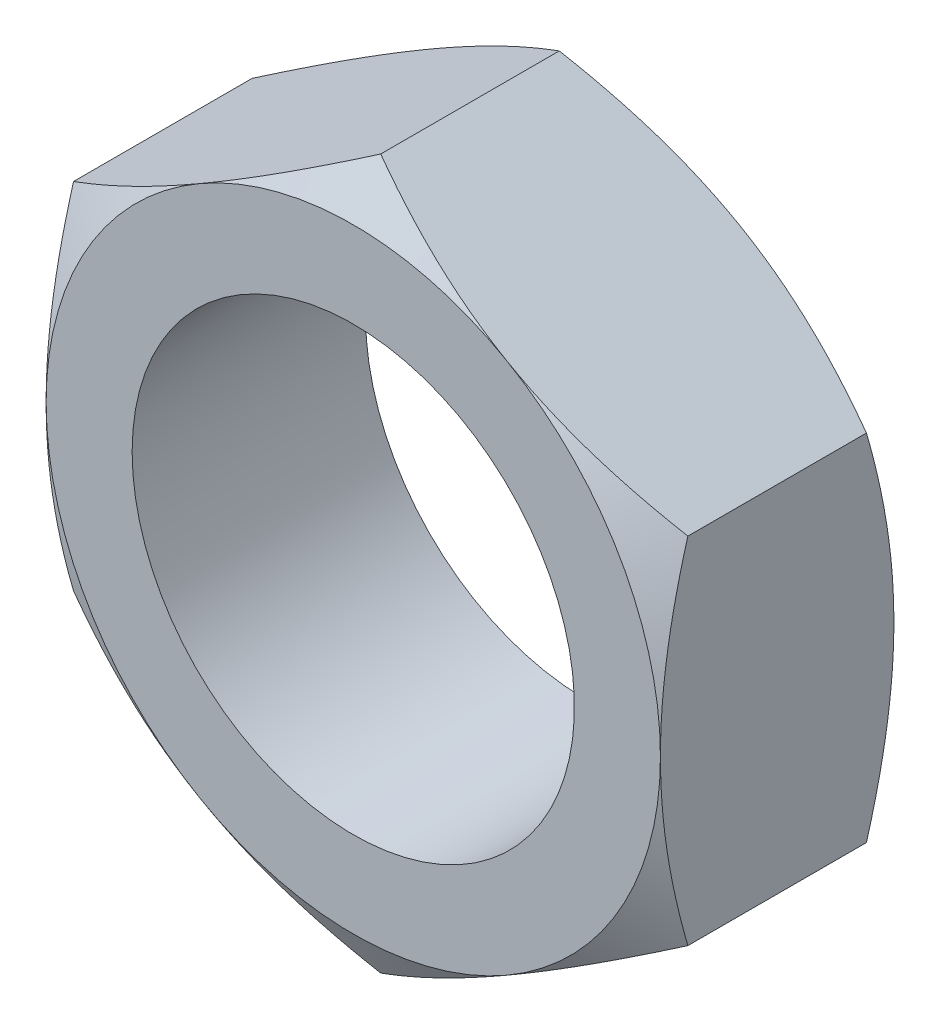
from build123d import *

# Parameters (mm, degrees)
EXTRUDE1_DEPTH          = 1.843263891
SKETCH13_R              = 3.4925
BOSS_EXTRUDE1_DEPTH     = 3.686524
SKETCH7_OUTSIDE_W       = 102.744
SKETCH7_OUTSIDE_H       = 104.244
SKETCH7_OUTSIDE_R       = 4.850694444
EXTRUDE2_DEPTH          = 25.4
EXTRUDE2_DRAFT          = -60
MIRROR2_COPY_1_SKETCH_W = 102.744
MIRROR2_COPY_1_SKETCH_H = 104.244
MIRROR2_COPY_1_SKETCH_R = 4.850694444
MIRROR2_COPY_1_DEPTH    = 25.4
MIRROR2_COPY_1_DRAFT    = -60


with BuildPart() as part:
    # Sketch1 → Extrude1 (new, symmetric)
    with BuildSketch(Plane.XY):
        Polygon((-4.850694444, 2.800549743), (-4.850694444, -2.800549743), (0, -5.601099487), (4.850694444, -2.800549743), (4.850694444, 2.800549743), (0, 5.601099487), align=None)
    extrude(amount=EXTRUDE1_DEPTH, both=True)

    # Cut-Extrude2 cone 1 section (through the dimple's axis) → Cut-Extrude2 (revolve, cut)
    with BuildSketch(Plane(origin=(0, 0, 1.843263891), x_dir=(0, -1, 0), z_dir=(1, 0, 0))):
        Polygon((0, 0), (3.4925, 0), (0, 3.4925), align=None)
    revolve(axis=Axis((0, 0, 1.843263891), (0, 0, -1)), mode=Mode.SUBTRACT)

    # Cut-Extrude3 cone 1 section (through the dimple's axis) → Cut-Extrude3 (revolve, cut)
    with BuildSketch(Plane(origin=(0, 0, -1.843263891), x_dir=(0, 1, 0), z_dir=(1, 0, 0))):
        Polygon((0, 0), (3.4925, 0), (0, 3.4925), align=None)
    revolve(axis=Axis((0, 0, -1.843263891), (0, 0, 1)), mode=Mode.SUBTRACT)


with BuildPart() as body_2:
    # Sketch13 → Boss-Extrude1 (new body)
    with BuildSketch(Plane(origin=(0, 0, -1.843263891), x_dir=(-1, 0, 0), z_dir=(0, 0, -1))):
        Circle(SKETCH13_R)
    extrude(amount=-BOSS_EXTRUDE1_DEPTH)


with BuildPart() as part_1:
    add(part.part)

    # Combine1: cut body 2
    add(body_2.part, mode=Mode.SUBTRACT)


with BuildPart() as extrude2_tool:
    # Sketch7 outside → Extrude2 (with draft: the straight prism first)
    with BuildSketch(Plane.XY.offset(1.843263891)):
        Rectangle(SKETCH7_OUTSIDE_W, SKETCH7_OUTSIDE_H)
        Circle(SKETCH7_OUTSIDE_R, mode=Mode.SUBTRACT)
    extrude(amount=-EXTRUDE2_DEPTH)
    # Extrude2: the draft: its side faces are tilted about the plane it starts from
    extrude2_sides = [extrude2_tool.faces().sort_by_distance(p)[0] for p in [
        (0, -52.122, -10.856736109),
        (51.372, 0, -10.856736109),
        (0, 52.122, -10.856736109),
        (-51.372, 0, -10.856736109),
        (-4.850694444, 0, -10.856736109),
    ]]
    draft(extrude2_sides, Plane.XY.offset(1.843263891), EXTRUDE2_DRAFT)


with BuildPart() as part_2:
    add(part_1.part)

    # Extrude2: cut by extrude2_tool
    add(extrude2_tool.part, mode=Mode.SUBTRACT)


with BuildPart() as mirror2_copy_1_tool:
    # Mirror2 copy 1 sketch → Mirror2 copy 1 (with draft: the straight prism first)
    with BuildSketch(Plane(origin=(0, 0, -1.843263891), x_dir=(1, 0, 0), z_dir=(0, 0, -1))):
        Rectangle(MIRROR2_COPY_1_SKETCH_W, MIRROR2_COPY_1_SKETCH_H)
        Circle(MIRROR2_COPY_1_SKETCH_R, mode=Mode.SUBTRACT)
    extrude(amount=-MIRROR2_COPY_1_DEPTH)
    # Mirror2 copy 1: the draft: its side faces are tilted about the plane it starts from
    mirror2_copy_1_sides = [mirror2_copy_1_tool.faces().sort_by_distance(p)[0] for p in [
        (0, -52.122, 10.856736109),
        (51.372, 0, 10.856736109),
        (0, 52.122, 10.856736109),
        (-51.372, 0, 10.856736109),
        (-4.850694444, 0, 10.856736109),
    ]]
    draft(mirror2_copy_1_sides, Plane(origin=(0, 0, -1.843263891), x_dir=(1, 0, 0), z_dir=(0, 0, -1)), MIRROR2_COPY_1_DRAFT)


with BuildPart() as part_3:
    add(part_2.part)

    # Mirror2 copy 1: cut by mirror2_copy_1_tool
    add(mirror2_copy_1_tool.part, mode=Mode.SUBTRACT)


solid = part_3.part
